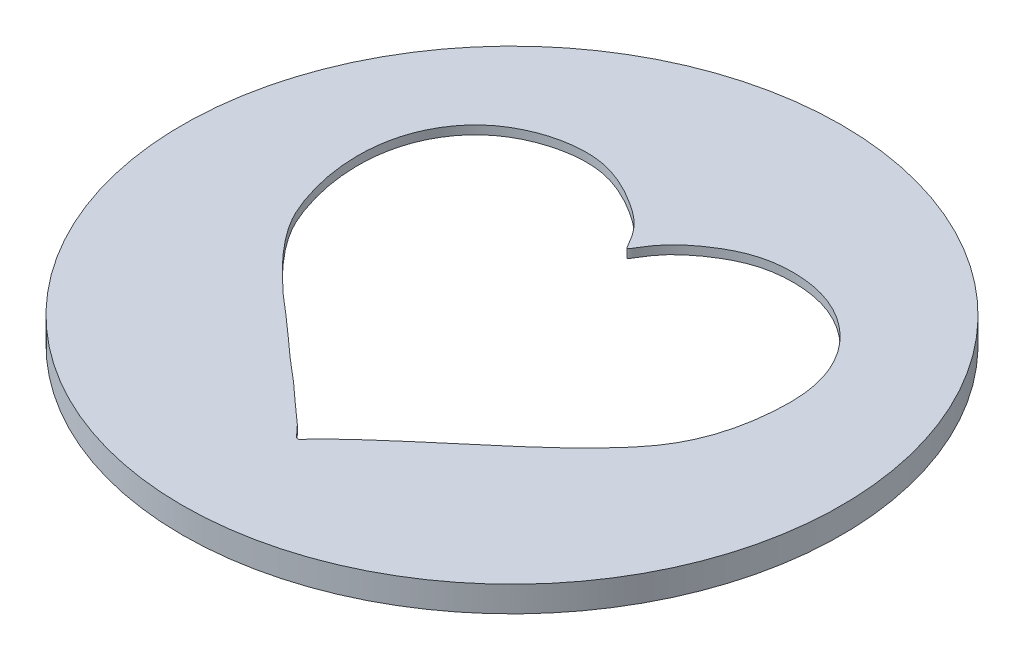
from build123d import *

# Parameters (mm, degrees)
SKETCH_1_R      = 38.5
EXTRUDE_1_DEPTH = 1
EXTRUDE_START   = 2
SKETCH_2_R      = 38.5
SKETCH_2_R_2    = 37.5
EXTRUDE_2_DEPTH = 2
EXTRUDE_START_2 = -1
SKETCH_3_R      = 38.5
SKETCH_3_R_2    = 37.5
EXTRUDE_3_DEPTH = 1


with BuildPart() as part:
    # 草图1 → 凸台-拉伸1 (new body)
    with BuildSketch(Plane(origin=(0, 0, 0), x_dir=(1, 0, 0), z_dir=(0, 1, 0))):
        with Locations(Location((35, 20, 0), (0, 0, 270))):
            Circle(SKETCH_1_R)
        with BuildLine():
            add(Edge.make_bspline(
                [(9.847677841, 26.963736175), (9.830280979, 28.766628322), (10.328625328, 32.599497459), (13.730324577, 38.157488663), (19.54253306, 40.830525519), (25.70644531, 40.970742856), (31.010192092, 38.112741312), (33.600123927, 35.970317049), (34.990505936, 33.320196263), (36.311893107, 35.692536685), (38.001750758, 37.388023235), (41.216086284, 39.469432017), (44.093619201, 40.573655795), (47.492933519, 40.903890496), (52.375017753, 40.174738781), (57.290219291, 36.827334292), (60.013775132, 31.251594502), (60.233836368, 24.35246219), (58.584059649, 17.318358706), (53.439877499, 11.363438259), (46.807387936, 5.341470011), (40.570434771, 0.326439576), (36.736882841, -3.324769371), (35.709778405, -4.256534815), (35.0289555, -5.317507345), (33.678488642, -3.620225676), (31.912648189, -2.232101715), (28.937544405, 0.616488039), (25.761350281, 3.146548208), (22.798811243, 6.012233974), (20.046157182, 8.222291751), (17.81728043, 10.333697492), (15.87042752, 12.295468633), (14.018935615, 14.45375852), (12.26093382, 16.96358248), (10.535707517, 21.185065373), (9.870526905, 24.595814929), (9.847677841, 26.963736175)],
                knots=[0, 0, 0, 0, 0.034602346, 0.073231114, 0.120202402, 0.150835562, 0.190180848, 0.227348414, 0.230138449, 0.232668194, 0.266920716, 0.28705329, 0.303468794, 0.32632939, 0.351886272, 0.397575242, 0.434238607, 0.467156147, 0.529381632, 0.567588282, 0.616606048, 0.703531448, 0.716153702, 0.724764396, 0.729948319, 0.734661525, 0.757644439, 0.78007523, 0.811318397, 0.836746798, 0.85922362, 0.879344593, 0.89588076, 0.912466948, 0.934146493, 0.954553227, 1, 1, 1, 1], degree=3))
        make_face(mode=Mode.SUBTRACT)
    extrude(amount=EXTRUDE_1_DEPTH)

    # 草图2 → 凸台-拉伸2 (add)
    with BuildSketch(Plane(origin=(0, 0, 0), x_dir=(-1, 0, 0), z_dir=(0, -1, 0)).offset(EXTRUDE_START)):
        with Locations(Location((-35, 20, 0), (0, 0, 90))):
            Circle(SKETCH_2_R)
        with Locations(Location((-35, 20, 0), (0, 0, 90))):
            Circle(SKETCH_2_R_2, mode=Mode.SUBTRACT)
    extrude(amount=-EXTRUDE_2_DEPTH)

    # 草图3 → 凸台-拉伸3 (add)
    with BuildSketch(Plane(origin=(0, 1, 0), x_dir=(1, 0, 0), z_dir=(0, 1, 0)).offset(EXTRUDE_START_2)):
        with Locations(Location((35, 20, 0), (0, 0, 90))):
            Circle(SKETCH_3_R)
        with Locations(Location((35, 20, 0), (0, 0, 90))):
            Circle(SKETCH_3_R_2, mode=Mode.SUBTRACT)
    extrude(amount=EXTRUDE_3_DEPTH)


solid = part.part
